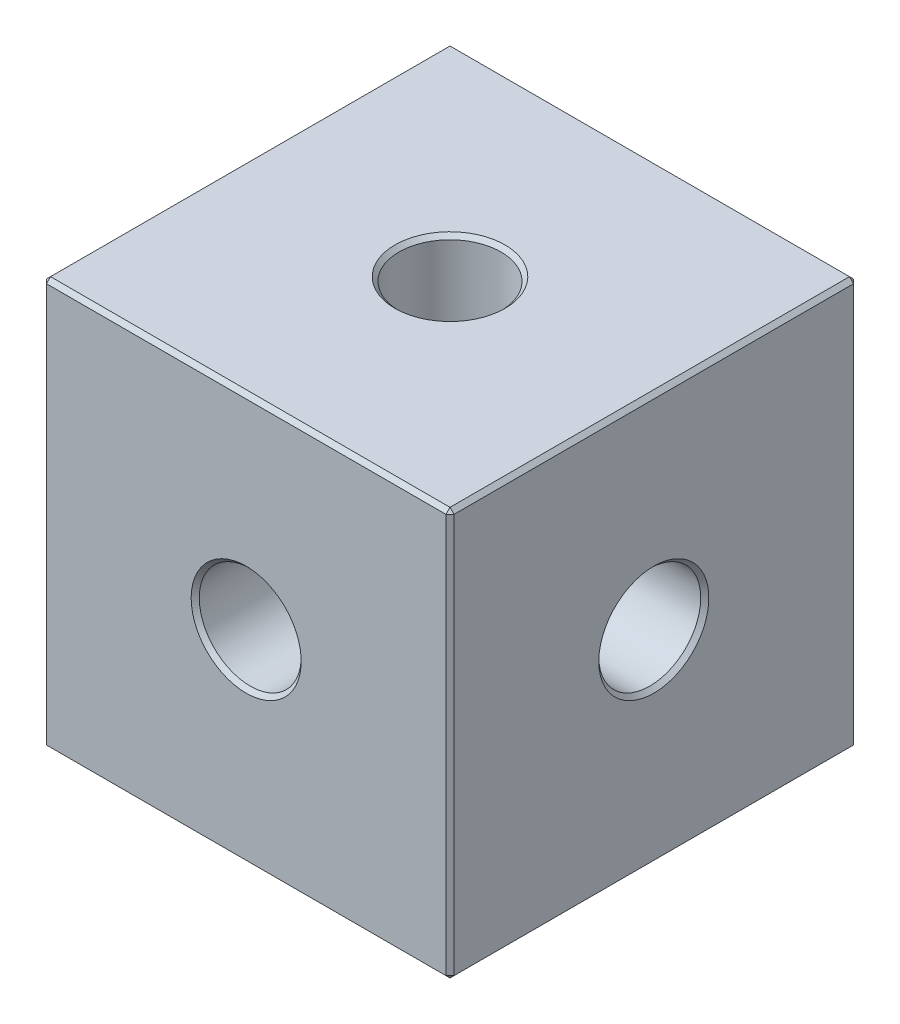
from build123d import *

# Parameters (mm, degrees)
SKETCH_1_W         = 20
SKETCH_1_H         = 20
EXTRUDE_1_DEPTH    = 10
HOLE_WIZARD_M6_1_D = 5
HOLE_WIZARD_M6_2_D = 5
HOLE_WIZARD_M6_3_D = 5
CHAMFER_1_SIZE     = 0.2


with BuildPart() as part:
    # 草图1 → 凸台-拉伸1 (new, symmetric)
    with BuildSketch(Plane(origin=(0, 0, 0), x_dir=(1, 0, 0), z_dir=(0, 1, 0))):
        Rectangle(SKETCH_1_W, SKETCH_1_H)
    extrude(amount=EXTRUDE_1_DEPTH, both=True)

    # M6 螺纹孔1 (through all)
    with Locations(Plane.XY.offset(10)):
        with Locations((0, 0)):
            Hole(HOLE_WIZARD_M6_1_D / 2)

    # M6 螺纹孔2 (through all)
    with Locations(Plane(origin=(0, 10, 0), x_dir=(1, 0, 0), z_dir=(0, 1, 0))):
        with Locations((0, 0)):
            Hole(HOLE_WIZARD_M6_2_D / 2)

    # M6 螺纹孔3 (through all)
    with Locations(Plane(origin=(10, 0, 0), x_dir=(0, 0, -1), z_dir=(1, 0, 0))):
        with Locations((0, 0)):
            Hole(HOLE_WIZARD_M6_3_D / 2)

    # 倒角1
    chamfer_1_edges = [part.edges().sort_by_distance(p)[0] for p in [
        (-10, 10, 0),
        (2.5, 0, 10),
        (2.5, 0, -10),
        (0, 10, 10),
        (2.5, -10, 0),
        (2.5, 10, 0),
        (-10, 0, -2.5),
        (10, 0, -2.5),
        (10, 10, 0),
        (0, -10, 10),
        (-10, -10, 0),
        (0, -10, -10),
        (10, -10, 0),
        (10, 0, 10),
        (-10, 0, 10),
        (-10, 0, -10),
        (10, 0, -10),
        (0, 10, -10),
    ]]
    chamfer(chamfer_1_edges, length=CHAMFER_1_SIZE)


solid = part.part
